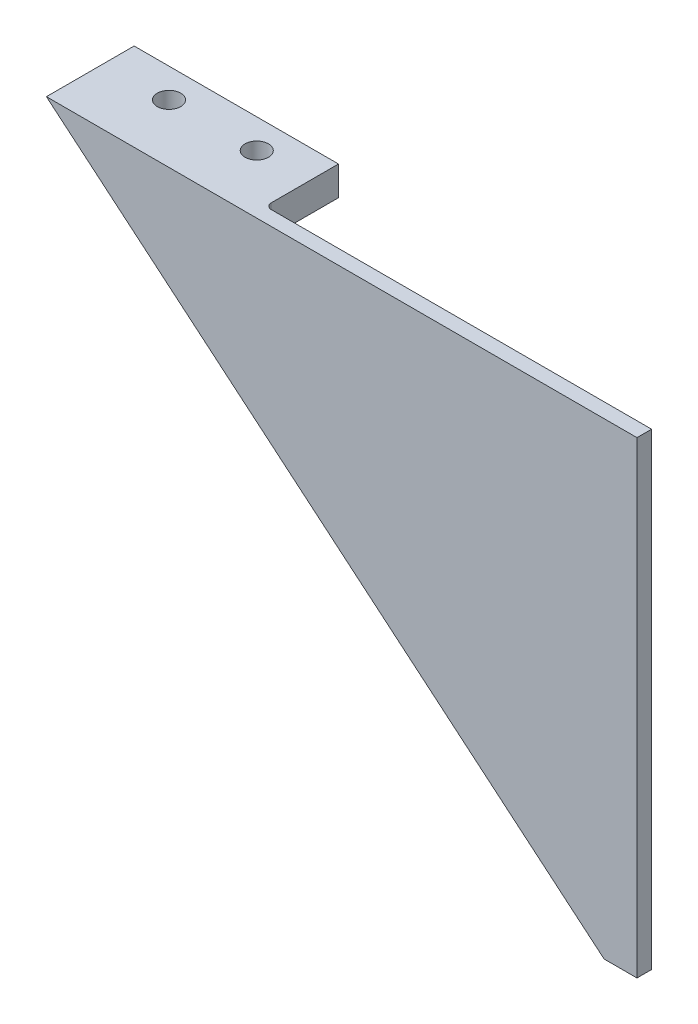
from build123d import *

# Parameters (mm, degrees)
SKETCH_2_W          = 280
SKETCH_2_H          = 150
EXTRUDE_1_DEPTH     = 5
SKETCH_3_W          = 280
SKETCH_3_H          = 25
EXTRUDE_2_DEPTH     = 10
CUT_EXTRUDE_1_DEPTH = 25
SKETCH_5_R          = 4
CUT_EXTRUDE_2_DEPTH = 50
SKETCH_6_W          = 5
SKETCH_6_H          = 160
EXTRUDE_3_DEPTH     = 20
EXTRUDE_4_DEPTH     = 5
CUT_EXTRUDE_3_DEPTH = 20
SKETCH_9_W          = 112.05
SKETCH_9_H          = 25
CUT_EXTRUDE_4_DEPTH = 20
FILLET_1_R          = 2


with BuildPart() as part:
    # 草图2 → 凸台-拉伸1 (new body)
    with BuildSketch(Plane.XY):
        Rectangle(SKETCH_2_W, SKETCH_2_H)
    extrude(amount=EXTRUDE_1_DEPTH)

    # 草图3 → 凸台-拉伸2 (add)
    with BuildSketch(Plane(origin=(0, 75, 0), x_dir=(1, 0, 0), z_dir=(0, 1, 0))):
        with Locations((0, 12.5)):
            Rectangle(SKETCH_3_W, SKETCH_3_H)
    extrude(amount=-EXTRUDE_2_DEPTH)

    # 草图4 → 切除-拉伸1 (cut, symmetric)
    with BuildSketch(Plane(origin=(0, 0, 0), x_dir=(-1, 0, 0), z_dir=(0, 0, -1))):
        Polygon((75.462063134, 103.147200408), (-172.007852349, -104.504714401), (179.32828037, -108.521449105), (159.998225544, 98.6463124), align=None)
    extrude(amount=CUT_EXTRUDE_1_DEPTH, both=True, mode=Mode.SUBTRACT)

    # 草图5 → 切除-拉伸2 (cut)
    with BuildSketch(Plane.XZ.offset(-65)):
        with Locations(Location((-20, -15, 0), (0, 0, 270))):
            Circle(SKETCH_5_R)
        with Locations(Location((10, -15, 0), (0, 0, 270))):
            Circle(SKETCH_5_R)
    extrude(amount=-CUT_EXTRUDE_2_DEPTH, mode=Mode.SUBTRACT)

    # 草图6 → 凸台-拉伸3 (add)
    with BuildSketch(Plane(origin=(140, 0, 0), x_dir=(0, 0, -1), z_dir=(1, 0, 0))):
        with Locations((-2.5, -5)):
            Rectangle(SKETCH_6_W, SKETCH_6_H)
    extrude(amount=EXTRUDE_3_DEPTH)

    # 草图7 → 凸台-拉伸4 (add)
    with BuildSketch(Plane.XY.offset(5)):
        Polygon((136.845502963, -75), (140, -77.6469373), (140, -75), align=None)
    extrude(amount=-EXTRUDE_4_DEPTH)

    # 草图8 → 切除-拉伸3 (cut)
    with BuildSketch(Plane.XY.offset(5)):
        Polygon((140, -77.6469373), (153.856787924, -89.274162936), (129.719459365, -89.898808536), align=None)
    extrude(amount=-CUT_EXTRUDE_3_DEPTH, mode=Mode.SUBTRACT)

    # 草图9 → 切除-拉伸4 (cut)
    with BuildSketch(Plane.XZ.offset(-65)):
        with Locations((83.975, -12.5)):
            Rectangle(SKETCH_9_W, SKETCH_9_H)
    extrude(amount=-CUT_EXTRUDE_4_DEPTH, mode=Mode.SUBTRACT)

    # 圆角1
    fillet_1_edges = [part.edges().sort_by_distance(p)[0] for p in [
        (27.95, 70, 0),
        (-1.025, 65, 0),
    ]]
    fillet(fillet_1_edges, radius=FILLET_1_R)


solid = part.part
